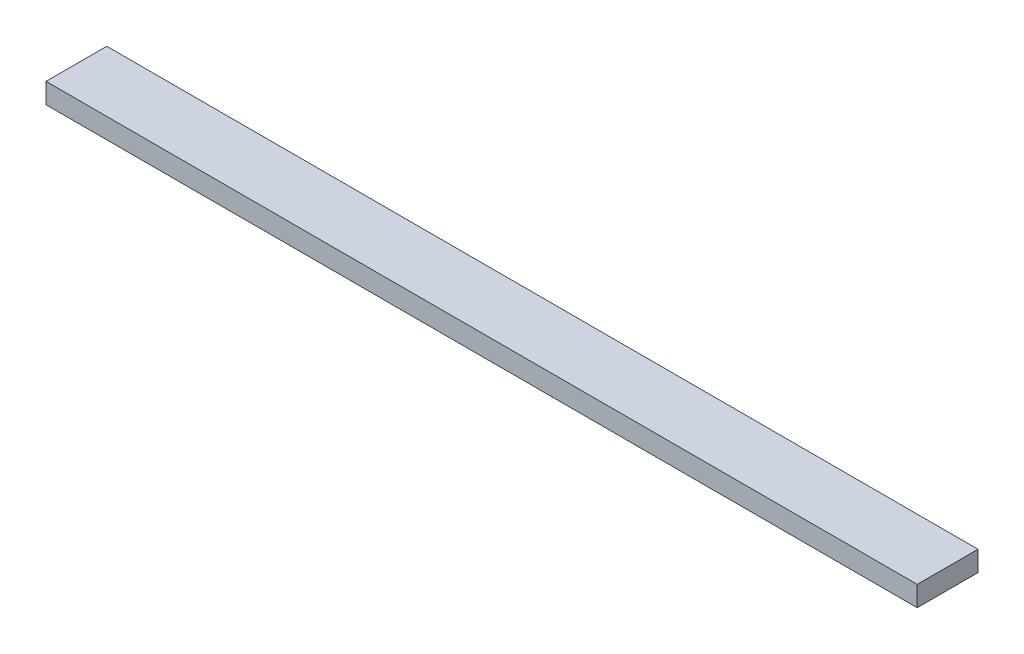
from build123d import *

# Parameters (mm, degrees)
SKETCH1_W           = 546.1
SKETCH1_H           = 38.1
BOSS_EXTRUDE1_DEPTH = 12.7


with BuildPart() as part:
    # Sketch1 → Boss-Extrude1 (new body)
    with BuildSketch(Plane(origin=(0, 0, 0), x_dir=(1, 0, 0), z_dir=(0, 1, 0))):
        with Locations((273.05, 19.05)):
            Rectangle(SKETCH1_W, SKETCH1_H)
    extrude(amount=BOSS_EXTRUDE1_DEPTH)


solid = part.part
